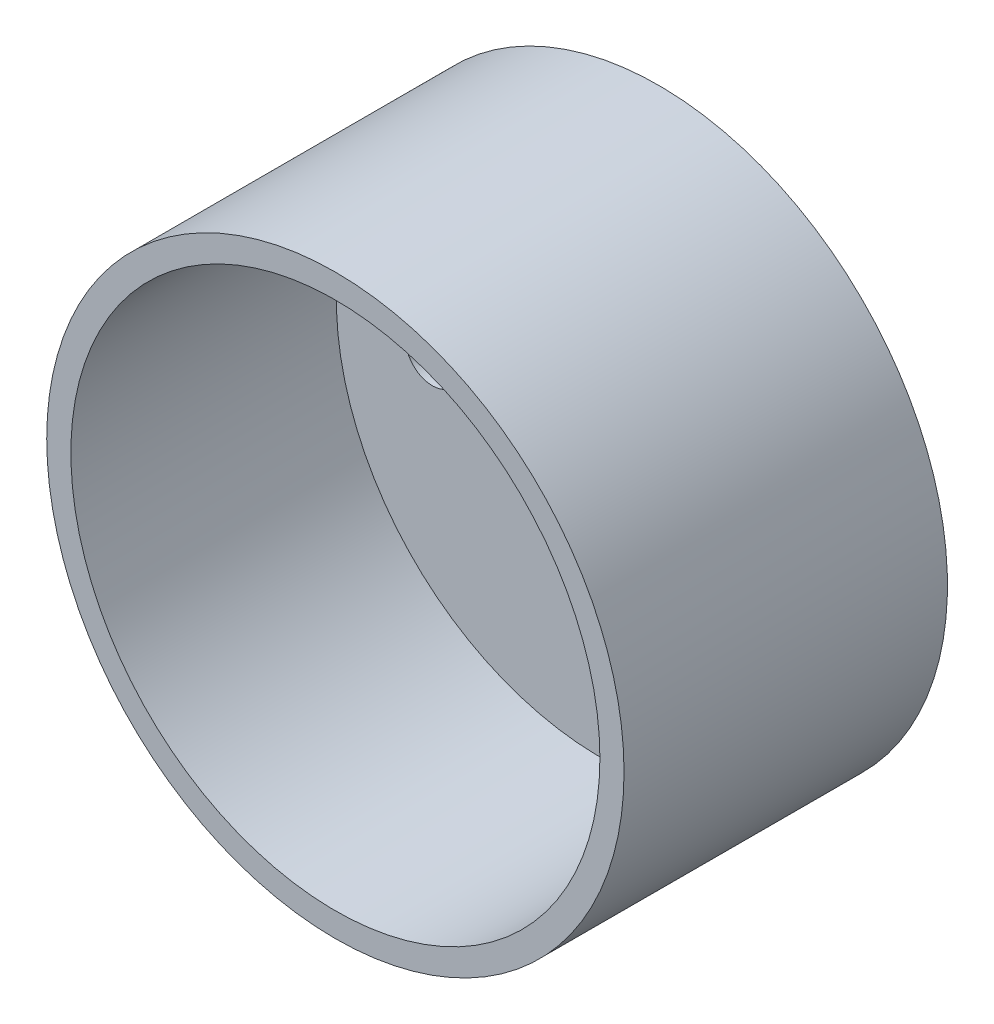
from build123d import *

# Parameters (mm, degrees)
SKETCH1_R           = 59.8
SKETCH1_R_2         = 54.8
BOSS_EXTRUDE1_DEPTH = 55
BOSS_EXTRUDE2_START = 12
SKETCH2_R           = 59.8
SKETCH2_R_2         = 15
SKETCH2_R_3         = 5.55625
BOSS_EXTRUDE2_DEPTH = 12


with BuildPart() as part:
    # Sketch1 → Boss-Extrude1 (new body)
    with BuildSketch(Plane.XY):
        Circle(SKETCH1_R)
        Circle(SKETCH1_R_2, mode=Mode.SUBTRACT)
    extrude(amount=BOSS_EXTRUDE1_DEPTH)

    # Sketch2 → Boss-Extrude2 (add)
    with BuildSketch(Plane(origin=(0, 0, 0), x_dir=(-1, 0, 0), z_dir=(0, 0, -1)).offset(BOSS_EXTRUDE2_START)):
        Circle(SKETCH2_R)
        Circle(SKETCH2_R_2, mode=Mode.SUBTRACT)
        with Locations((34.9, 0)):
            Circle(SKETCH2_R_3, mode=Mode.SUBTRACT)
    extrude(amount=-BOSS_EXTRUDE2_DEPTH)


solid = part.part
